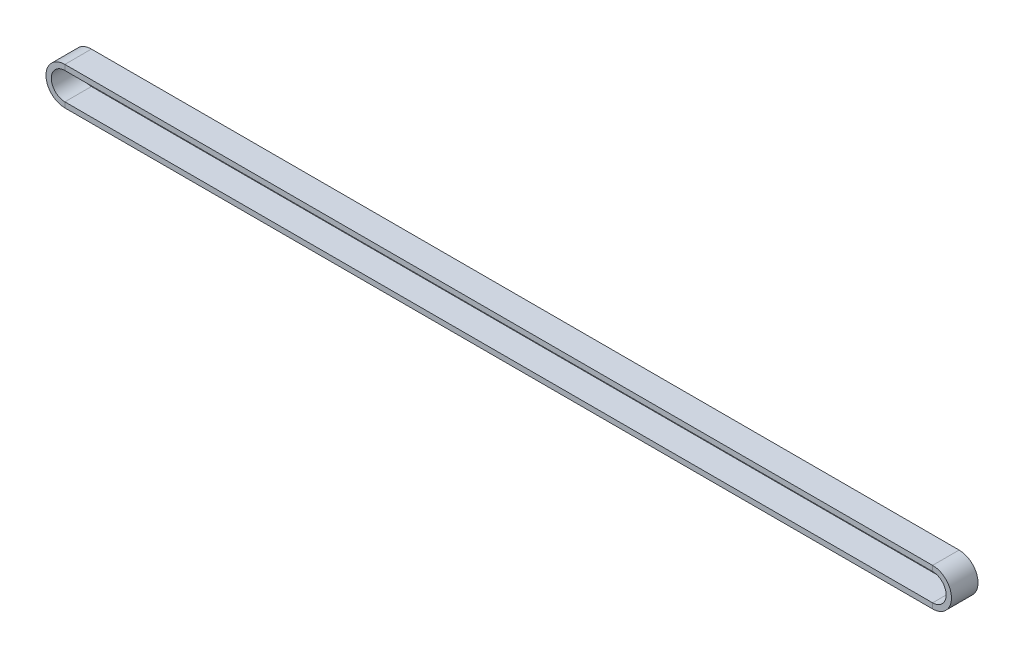
from build123d import *

# Parameters (mm, degrees)
SKETCH3_W = 10
SKETCH3_H = 2


with BuildPart() as part:
    # Sweep1: sweep along a path in Sketch2
    with BuildLine(Plane.XY) as sweep1_path:
        Line((0, 18.887796899), (-327, 18.887796899))
        ThreePointArc((-327, 18.887796899), (-333.112203101, 25), (-327, 31.112203101))
        Line((-327, 31.112203101), (0, 31.112203101))
        ThreePointArc((0, 31.112203101), (6.112203101, 25), (0, 18.887796899))
    # Sketch3 → Sweep1 (sweep)
    with BuildSketch(Plane(origin=(0, 0, 0), x_dir=(0, 0, -1), z_dir=(1, 0, 0))):
        with Locations((0, 31.112203101)):
            Rectangle(SKETCH3_W, SKETCH3_H)
    sweep(path=sweep1_path.line)


solid = part.part
